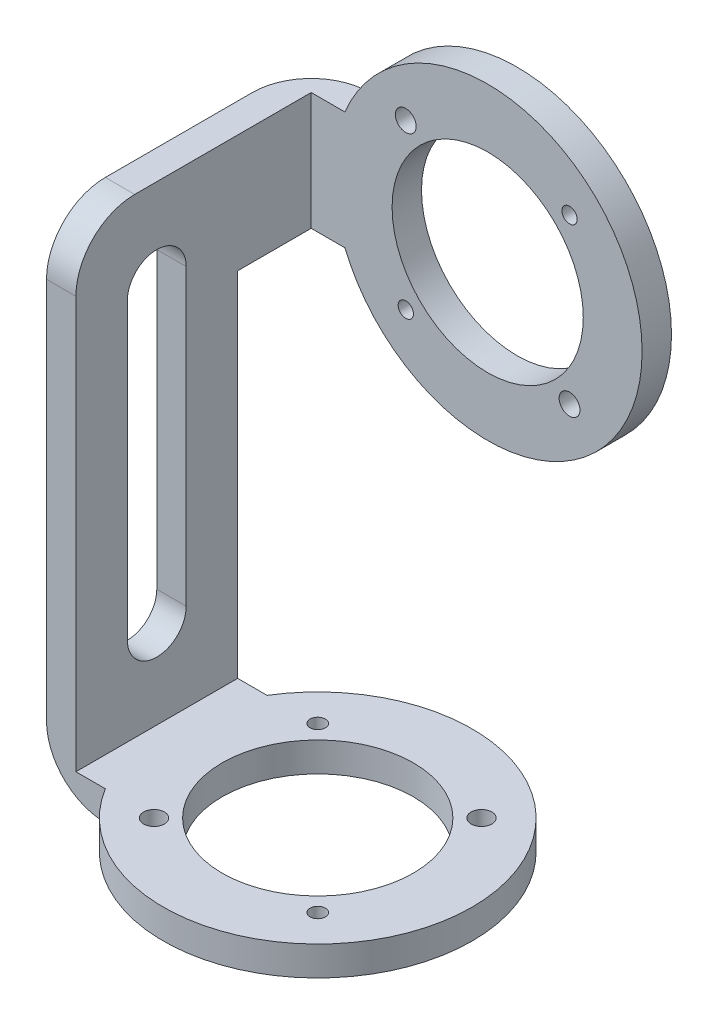
from build123d import *

# Parameters (mm, degrees)
SKETCH1_R           = 33.3375
SKETCH1_R_2         = 2.25
SKETCH1_R_3         = 1.65
SKETCH1_R_4         = 20.6375
BOSS_EXTRUDE1_DEPTH = 6.35
BOSS_EXTRUDE3_DEPTH = 6.35
SKETCH4_R           = 33.3375
SKETCH4_R_2         = 2.25
SKETCH4_R_3         = 1.65
SKETCH4_R_4         = 20.6375
BOSS_EXTRUDE4_DEPTH = 6.35
FILLET1_R           = 12.7
FILLET2_R           = 12.7
FILLET3_R           = 12.7


with BuildPart() as part:
    # Sketch1 → Boss-Extrude1 (new body)
    # profile 1 of 2: a face of its own
    with BuildSketch(Plane.XY):
        Circle(SKETCH1_R)
        with Locations((-17.67766953, 17.67766953)):
            Circle(SKETCH1_R_2, mode=Mode.SUBTRACT)
        with Locations((17.67766953, 17.67766953)):
            Circle(SKETCH1_R_3, mode=Mode.SUBTRACT)
        with Locations((17.67766953, -17.67766953)):
            Circle(SKETCH1_R_2, mode=Mode.SUBTRACT)
        with Locations((-17.67766953, -17.67766953)):
            Circle(SKETCH1_R_3, mode=Mode.SUBTRACT)
        Circle(SKETCH1_R_4, mode=Mode.SUBTRACT)
    # profile 2 of 2: a face of its own
    with BuildSketch(Plane.XY):
        with BuildLine():
            ThreePointArc((-30.823674444, -12.7), (-33.3375, 0), (-30.823674444, 12.7))
            Line((-30.823674444, 12.7), (-38.1, 12.7))
            Line((-38.1, 12.7), (-38.1, -12.7))
            Line((-38.1, -12.7), (-30.823674444, -12.7))
        make_face()
    extrude(amount=BOSS_EXTRUDE1_DEPTH)

    # Sketch2 → Boss-Extrude3 (add)
    with BuildSketch(Plane.ZY.offset(38.1)):
        Polygon((0, 12.7), (57.15, 12.7), (57.15, -88.9), (22.225, -88.9), (22.225, -12.7), (0, -12.7), align=None)
        with BuildLine():
            Line((46.0375, -6.35), (46.0375, -69.85))
            ThreePointArc((46.0375, -69.85), (39.6875, -76.2), (33.3375, -69.85))
            Line((33.3375, -69.85), (33.3375, -6.35))
            ThreePointArc((33.3375, -6.35), (39.6875, 0), (46.0375, -6.35))
        make_face(mode=Mode.SUBTRACT)
    extrude(amount=BOSS_EXTRUDE3_DEPTH)

    # Sketch4 → Boss-Extrude4 (add)
    # profile 1 of 2: a face of its own
    with BuildSketch(Plane(origin=(0, -88.9, 0), x_dir=(-1, 0, 0), z_dir=(0, -1, 0))):
        with BuildLine():
            ThreePointArc((36.689436686, -39.6875), (35.430818695, -48.761321425), (31.75, -57.15))
            Line((31.75, -57.15), (44.45, -57.15))
            Line((44.45, -57.15), (44.45, -22.225))
            Line((44.45, -22.225), (31.75, -22.225))
            ThreePointArc((31.75, -22.225), (35.430818695, -30.613678575), (36.689436686, -39.6875))
        make_face()
    # profile 2 of 2: a face of its own
    with BuildSketch(Plane(origin=(0, -88.9, 0), x_dir=(-1, 0, 0), z_dir=(0, -1, 0))):
        with Locations((3.351936686, -39.6875)):
            Circle(SKETCH4_R)
        with Locations(Location((21.029606215, -57.36516953, 0), (0, 0, 90))):
            Circle(SKETCH4_R_2, mode=Mode.SUBTRACT)
        with Locations(Location((-14.325732844, -57.36516953, 0), (0, 0, 90))):
            Circle(SKETCH4_R_3, mode=Mode.SUBTRACT)
        with Locations(Location((-14.325732844, -22.00983047, 0), (0, 0, 90))):
            Circle(SKETCH4_R_2, mode=Mode.SUBTRACT)
        with Locations(Location((21.029606215, -22.00983047, 0), (0, 0, 90))):
            Circle(SKETCH4_R_3, mode=Mode.SUBTRACT)
        with Locations(Location((3.351936686, -39.6875, 0), (0, 0, 90))):
            Circle(SKETCH4_R_4, mode=Mode.SUBTRACT)
    extrude(amount=BOSS_EXTRUDE4_DEPTH)

    # Fillet1
    fillet1_edges = [part.edges().sort_by_distance(p)[0] for p in [
        (-44.45, 0, 0),
    ]]
    fillet(fillet1_edges, radius=FILLET1_R)

    # Fillet2
    fillet2_edges = [part.edges().sort_by_distance(p)[0] for p in [
        (-44.45, -95.25, 39.6875),
    ]]
    fillet(fillet2_edges, radius=FILLET2_R)

    # Fillet3
    fillet3_edges = [part.edges().sort_by_distance(p)[0] for p in [
        (-41.275, 12.7, 57.15),
    ]]
    fillet(fillet3_edges, radius=FILLET3_R)


solid = part.part
